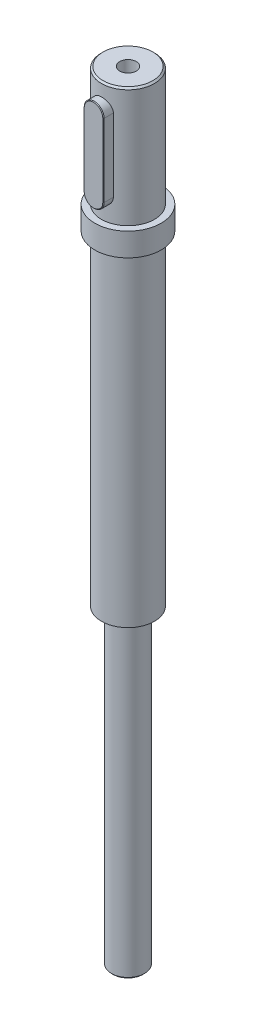
from build123d import *

# Parameters (mm, degrees)
SKETCH_1_R      = 2.5
EXTRUDE_1_DEPTH = 47
EXTRUDE_START   = 47
SKETCH_2_R      = 4
EXTRUDE_2_DEPTH = 49
EXTRUDE_START_2 = 96
SKETCH_3_R      = 5
EXTRUDE_3_DEPTH = 3.5
EXTRUDE_START_3 = 99.5
SKETCH_4_R      = 4
EXTRUDE_4_DEPTH = 18
EXTRUDE_START_4 = 2.2
EXTRUDE_5_DEPTH = 3
CHAMFER_1_SIZE  = 0.25
CHAMFER_2_SIZE  = 0.1


with BuildPart() as part:
    # 草图1 → 凸台-拉伸1 (new body)
    with BuildSketch(Plane(origin=(0, 0, 0), x_dir=(1, 0, 0), z_dir=(0, 1, 0))):
        with Locations(Location((0, 0, 0), (0, 0, 270))):
            Circle(SKETCH_1_R)
    extrude(amount=EXTRUDE_1_DEPTH)

    # 草图2 → 凸台-拉伸2 (add)
    with BuildSketch(Plane(origin=(0, 0, 0), x_dir=(1, 0, 0), z_dir=(0, 1, 0)).offset(EXTRUDE_START)):
        with Locations(Location((0, 0, 0), (0, 0, 270))):
            Circle(SKETCH_2_R)
    extrude(amount=EXTRUDE_2_DEPTH)

    # 草图3 → 凸台-拉伸3 (add)
    with BuildSketch(Plane(origin=(0, 0, 0), x_dir=(1, 0, 0), z_dir=(0, 1, 0)).offset(EXTRUDE_START_2)):
        with Locations(Location((0, 0, 0), (0, 0, 270))):
            Circle(SKETCH_3_R)
    extrude(amount=EXTRUDE_3_DEPTH)

    # 草图4 → 凸台-拉伸4 (add)
    with BuildSketch(Plane(origin=(0, 0, 0), x_dir=(1, 0, 0), z_dir=(0, 1, 0)).offset(EXTRUDE_START_3)):
        with Locations(Location((0, 0, 0), (0, 0, 270))):
            Circle(SKETCH_4_R)
    extrude(amount=EXTRUDE_4_DEPTH)

    # 草图9 → M3 螺纹孔1 (revolve, cut)
    with BuildSketch(Plane(origin=(0, 117.5, 0), x_dir=(0, 0, 1), z_dir=(1, 0, 0))):
        Polygon((0, 0), (0, 10.751075774), (1.25, 10), (1.25, 0), align=None)
    revolve(axis=Axis((0, 123.85, 0), (0, -1, 0)), mode=Mode.SUBTRACT)

    # 草图11 → 凸台-拉伸5 (add)
    with BuildSketch(Plane.XY.offset(EXTRUDE_START_4)):
        with BuildLine():
            Line((-1.5, 103), (-1.5, 114))
            ThreePointArc((-1.5, 114), (0, 115.5), (1.5, 114))
            Line((1.5, 114), (1.5, 103))
            ThreePointArc((1.5, 103), (0, 101.5), (-1.5, 103))
        make_face()
    extrude(amount=EXTRUDE_5_DEPTH)

    # 倒角1
    chamfer_1_edges = [part.edges().sort_by_distance(p)[0] for p in [
        (0, 117.5, -4),
        (0, 0, -2.5),
    ]]
    chamfer(chamfer_1_edges, length=CHAMFER_1_SIZE)

    # 倒角2
    chamfer_2_edges = [part.edges().sort_by_distance(p)[0] for p in [
        (0, 101.5, 5.2),
        (1.5, 108.5, 5.2),
        (0, 115.5, 5.2),
        (-1.5, 108.5, 5.2),
    ]]
    chamfer(chamfer_2_edges, length=CHAMFER_2_SIZE)


solid = part.part
